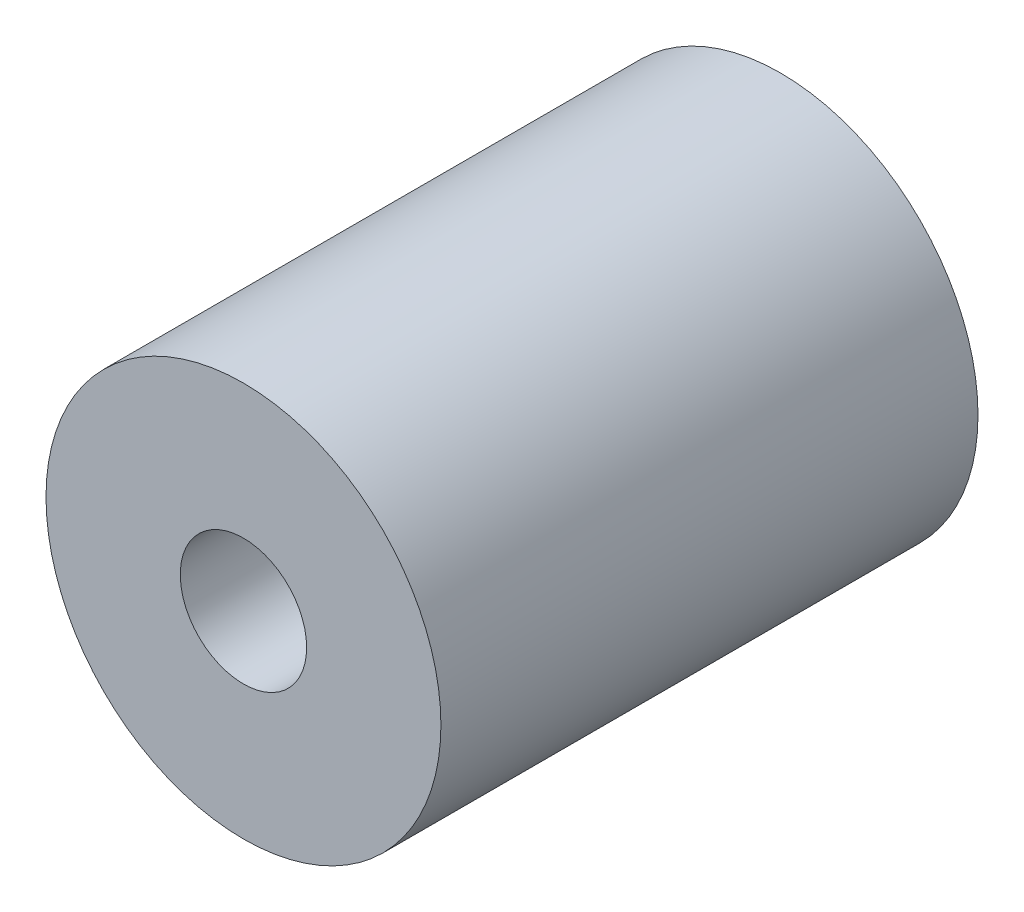
from build123d import *

# Parameters (mm, degrees)
SKIZZE1_R                       = 12.5
AUFSATZ_LINEAR_AUSTRAGEN1_DEPTH = 34
SKIZZE2_R                       = 4
SCHNITT_LINEAR_AUSTRAGEN1_DEPTH = 12
SCHNITT_LINEAR_START            = -12
SKIZZE3_R                       = 4
SCHNITT_LINEAR_AUSTRAGEN2_DEPTH = 12


with BuildPart() as part:
    # Skizze1 → Aufsatz-Linear austragen1 (new body)
    with BuildSketch(Plane.XY):
        Circle(SKIZZE1_R)
    extrude(amount=AUFSATZ_LINEAR_AUSTRAGEN1_DEPTH)

    # Skizze2 → Schnitt-Linear austragen1 (cut)
    with BuildSketch(Plane.XY.offset(34)):
        Circle(SKIZZE2_R)
    extrude(amount=-SCHNITT_LINEAR_AUSTRAGEN1_DEPTH, mode=Mode.SUBTRACT)

    # Skizze3 → Schnitt-Linear austragen2 (cut)
    with BuildSketch(Plane(origin=(0, 0, 0), x_dir=(-1, 0, 0), z_dir=(0, 0, -1)).offset(SCHNITT_LINEAR_START)):
        with Locations(Location((0, 0, 0), (0, 0, 180))):
            Circle(SKIZZE3_R)
    extrude(amount=SCHNITT_LINEAR_AUSTRAGEN2_DEPTH, mode=Mode.SUBTRACT)


solid = part.part
